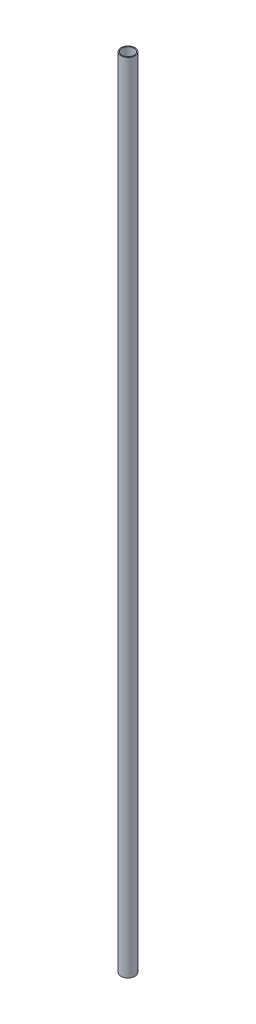
from build123d import *

# Parameters (mm, degrees)
SKETCH_1_R      = 8
SKETCH_1_R_2    = 7
EXTRUDE_1_DEPTH = 913


with BuildPart() as part:
    # 草图1 → 凸台-拉伸1 (new body)
    with BuildSketch(Plane(origin=(0, 0, 0), x_dir=(1, 0, 0), z_dir=(0, 1, 0))):
        Circle(SKETCH_1_R)
        Circle(SKETCH_1_R_2, mode=Mode.SUBTRACT)
    extrude(amount=EXTRUDE_1_DEPTH)


solid = part.part
